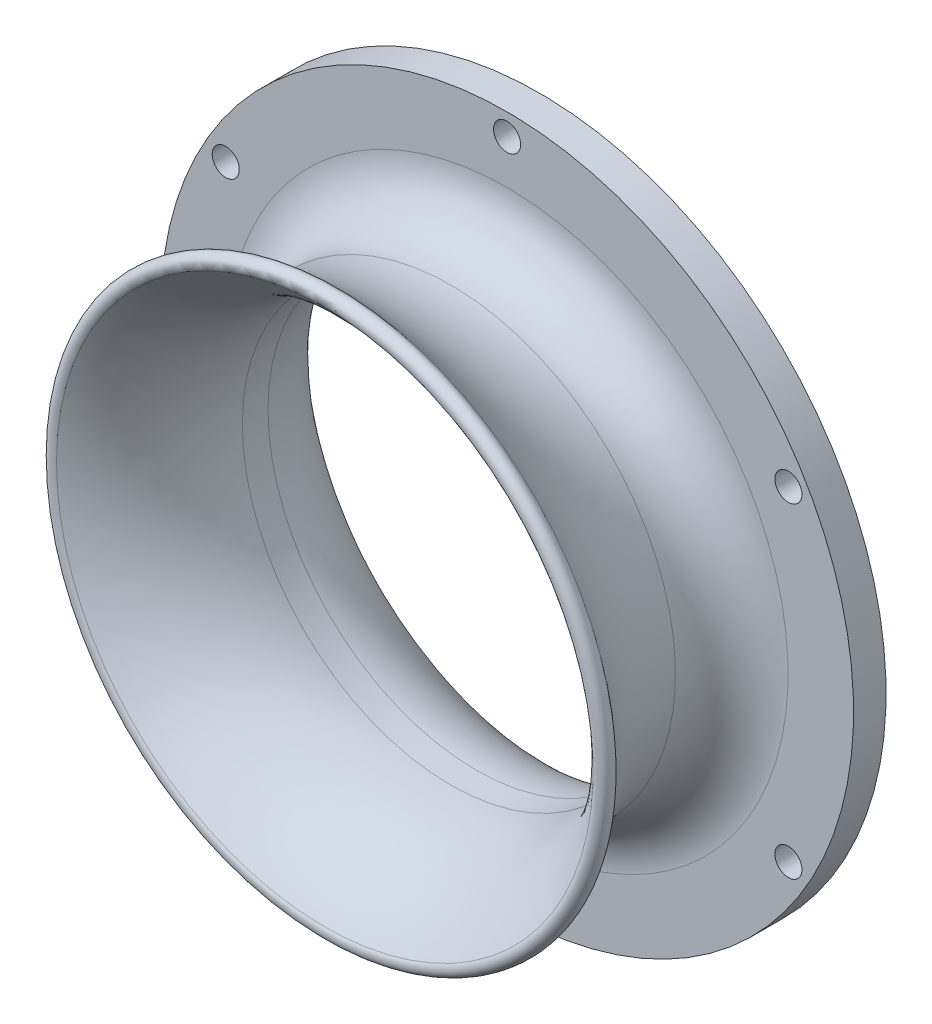
from build123d import *

# Parameters (mm, degrees)
CIRPATTERN1_COUNT = 6


with BuildPart() as part:
    # Sketch1 → Revolve1 (revolve)
    with BuildSketch(Plane(origin=(0, 0, 0), x_dir=(0, 0, -1), z_dir=(1, 0, 0))):
        with BuildLine():
            Line((2.370362408, 19.25), (0, 19.25))
            ThreePointArc((0, 19.25), (-6.439325621, 20.702487846), (-11.631578947, 24.77865526))
            ThreePointArc((-11.631578947, 24.77865526), (-11.523567237, 25.833801444), (-10.468421053, 25.725789734))
            ThreePointArc((-10.468421053, 25.725789734), (-5.795393058, 22.057239062), (0, 20.75))
            ThreePointArc((0, 20.75), (3.676955262, 22.273044738), (5.2, 25.95))
            Line((5.2, 25.95), (5.2, 32))
            Line((5.2, 32), (8.2, 32))
            Line((8.2, 32), (8.2, 27.5))
            Line((8.2, 27.5), (11.2, 27.5))
            ThreePointArc((11.2, 27.5), (8.412402627, 21.633451462), (2.370362408, 19.25))
        make_face()
    revolve(axis=Axis((0, 0, 0), (0, 0, 1)))

    # Sketch2 → Ø2.5 (2.5) Diameter Hole1 (revolve, cut)
    with BuildSketch(Plane(origin=(0, 30, -5.2), x_dir=(0, -1, 0), z_dir=(1, 0, 0))):
        Polygon((0, 0), (0, 23.751075774), (1.25, 23), (1.25, 0), align=None)
    f_2_5_2_5_diameter_hole1 = revolve(axis=Axis((0, 30, 1.15), (0, 0, -1)), mode=Mode.SUBTRACT)

    # CirPattern1: Ø2.5 (2.5) Diameter Hole1 ×6 about axis
    cirpattern1_axis = Axis((0, 0, 12.95), (0, 0, -1))
    for i in range(1, CIRPATTERN1_COUNT):
        add(f_2_5_2_5_diameter_hole1.rotate(cirpattern1_axis, i * 360 / CIRPATTERN1_COUNT), mode=Mode.SUBTRACT)


solid = part.part
